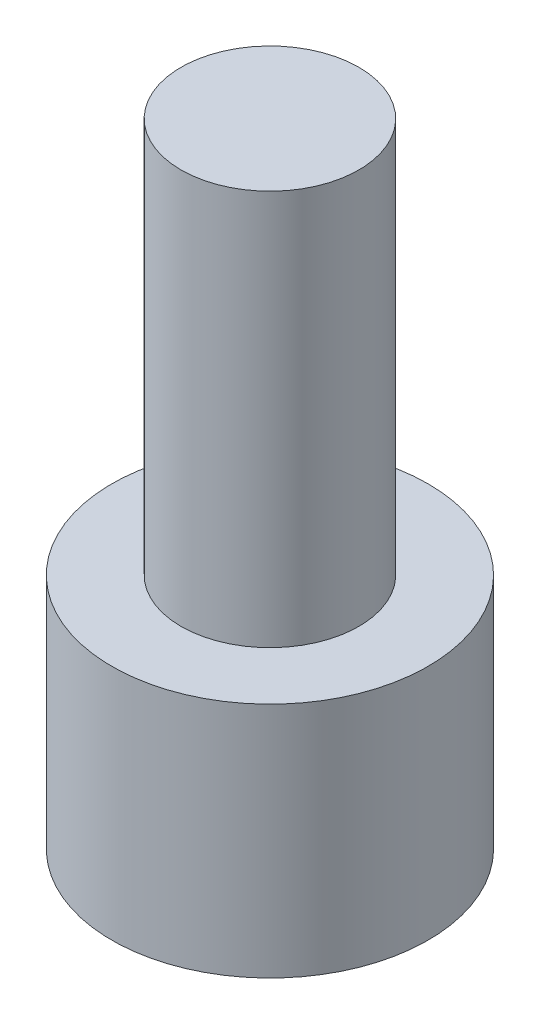
from build123d import *

# Parameters (mm, degrees)
ESBO_O1_R                = 2.25
RESSALTO_EXTRUS_O1_DEPTH = 10
ESBO_O3_R                = 4
RESSALTO_EXTRUS_O2_DEPTH = 6
ESBO_O4_R                = 2.25
CORTE_EXTRUS_O1_DEPTH    = 2


with BuildPart() as part:
    # Esboço1 → Ressalto-extrusão1 (new body)
    with BuildSketch(Plane(origin=(0, 0, 0), x_dir=(1, 0, 0), z_dir=(0, 1, 0))):
        with Locations(Location((0, 0, 0), (0, 0, 270))):
            Circle(ESBO_O1_R)
    extrude(amount=RESSALTO_EXTRUS_O1_DEPTH)

    # Esboço3 → Ressalto-extrusão2 (add)
    with BuildSketch(Plane.XZ):
        with Locations(Location((0, 0, 0), (0, 0, 270))):
            Circle(ESBO_O3_R)
    extrude(amount=RESSALTO_EXTRUS_O2_DEPTH)

    # Esboço4 → Corte-extrusão1 (cut)
    with BuildSketch(Plane.XZ.offset(6)):
        with Locations(Location((0, 0, 0), (0, 0, 90))):
            Circle(ESBO_O4_R)
    extrude(amount=-CORTE_EXTRUS_O1_DEPTH, mode=Mode.SUBTRACT)


solid = part.part
